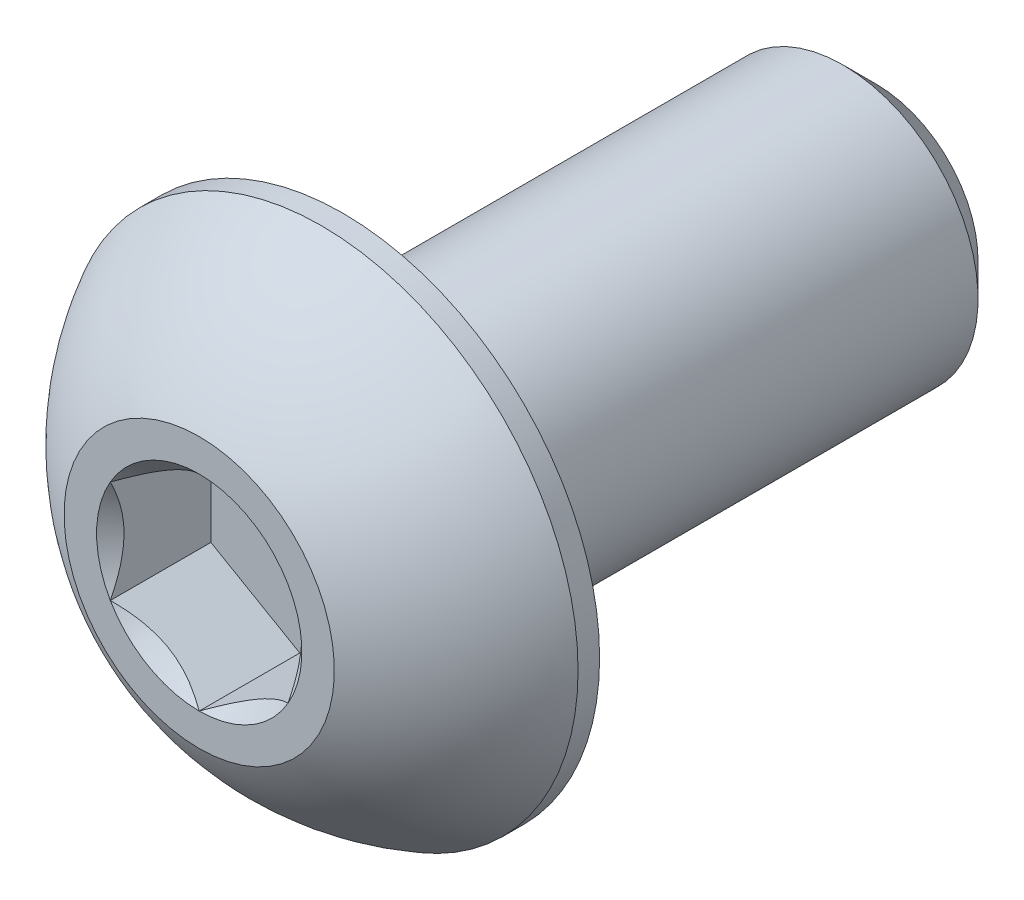
from build123d import *

# Parameters (mm, degrees)
SKETCH1_W          = 9.525
SKETCH1_H          = 2.413
CHAMFER1_SIZE      = 0.5953125
CUT_EXTRUDE2_DEPTH = 1.79578
SKETCH6_R          = 1.833087105
CUT_EXTRUDE3_DEPTH = 1.79578
CUT_EXTRUDE3_TAPER = 45


with BuildPart() as part:
    # Sketch1 → Revolve1 (revolve)
    with BuildSketch(Plane(origin=(0, 0, 0), x_dir=(0, 0, -1), z_dir=(1, 0, 0))):
        with Locations((7.3279, 1.2065)):
            Rectangle(SKETCH1_W, SKETCH1_H)
    revolve(axis=Axis((0, 0, -12.0904), (0, 0, 1)))

    # Chamfer1
    chamfer1_edges = [part.edges().sort_by_distance(p)[0] for p in [
        (0, -2.413, -12.0904),
    ]]
    chamfer(chamfer1_edges, length=CHAMFER1_SIZE)

    # Sketch7 → Revolve2 (revolve)
    with BuildSketch(Plane(origin=(0, 0, 0), x_dir=(0, 0, -1), z_dir=(1, 0, 0)), mode=Mode.PRIVATE) as revolve2_sk:
        with BuildLine():
            Line((2.18059, 4.5847), (2.5654, 4.5847))
            Line((2.5654, 4.5847), (2.5654, 0))
            Line((2.5654, 0), (0, 0))
            Line((0, 0), (0, 2.413))
            ThreePointArc((0, 2.413), (0.925030326, 3.664791196), (2.18059, 4.5847))
        make_face()
    revolve(revolve2_sk.sketch.rotate(Axis((0, 0, 0), (0, 0, -1)), 180), axis=Axis((0, 0, 0), (0, 0, -1)))

    # Sketch5 → Cut-Extrude2 (cut)
    with BuildSketch(Plane.XY):
        Polygon((1.5875, -0.916543552), (1.5875, 0.916543552), (0, 1.833087105), (-1.5875, 0.916543552), (-1.5875, -0.916543552), (0, -1.833087105), align=None)
    extrude(amount=-CUT_EXTRUDE2_DEPTH, mode=Mode.SUBTRACT)

    # Sketch6 → Cut-Extrude3 (cut)
    with BuildSketch(Plane.XY):
        Circle(SKETCH6_R)
    extrude(amount=-CUT_EXTRUDE3_DEPTH, taper=CUT_EXTRUDE3_TAPER, mode=Mode.SUBTRACT)


solid = part.part
